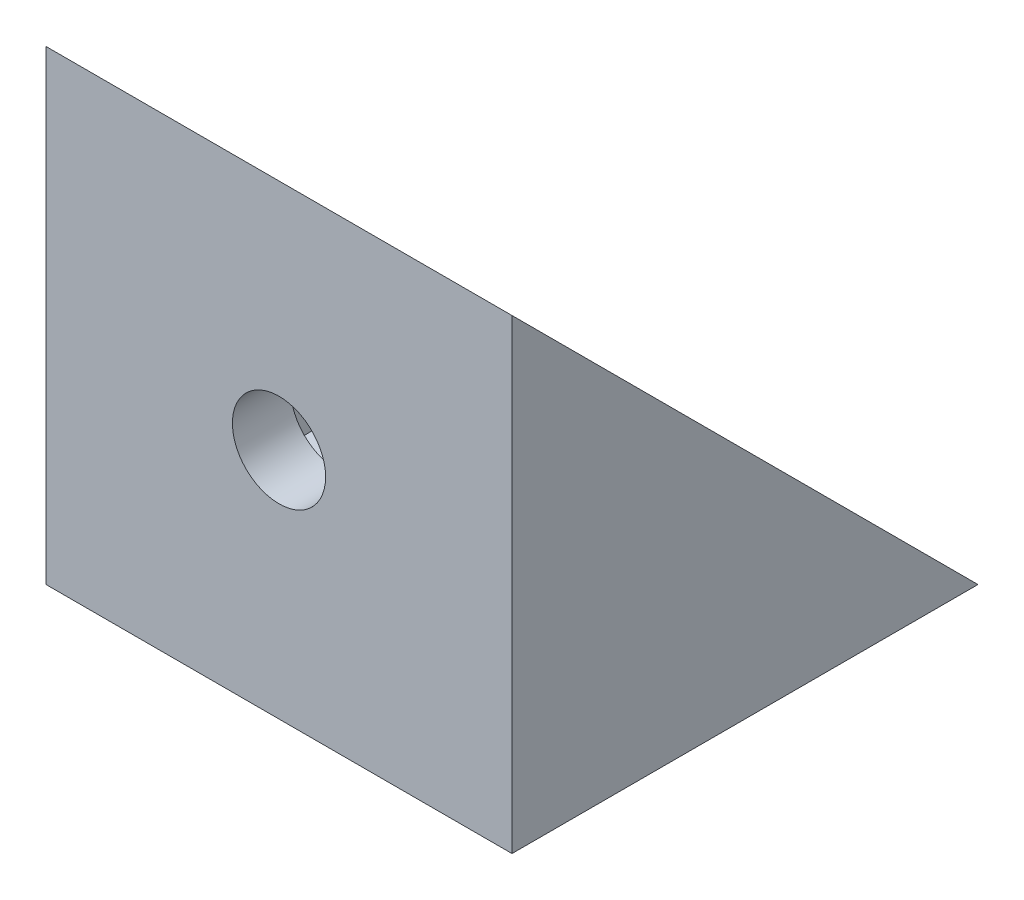
from build123d import *

# Parameters (mm, degrees)
AUFSATZ_LINEAR_AUSTRAGEN1_DEPTH      = 20
AUFSATZ_LINEAR_AUSTRAGEN1_DEPTH_BACK = 20
SCHNITT_LINEAR_AUSTRAGEN1_DEPTH      = 15
SCHNITT_LINEAR_AUSTRAGEN1_DEPTH_BACK = 15
SCHNITT_LINEAR_AUSTRAGEN2_REACH      = 62
SKIZZE3_R                            = 4
SCHNITT_LINEAR_AUSTRAGEN3_REACH      = 62
SKIZZE4_R                            = 4


with BuildPart() as part:
    # Skizze1 → Aufsatz-Linear austragen1 (new, two sides: drawn at the far end of the back side and taken through both)
    with BuildSketch(Plane(origin=(0, 0, 0), x_dir=(0, 0, -1), z_dir=(1, 0, 0)).offset(-AUFSATZ_LINEAR_AUSTRAGEN1_DEPTH_BACK)):
        Polygon((0, 0), (0, 40), (40, 0), align=None)
    extrude(amount=AUFSATZ_LINEAR_AUSTRAGEN1_DEPTH + AUFSATZ_LINEAR_AUSTRAGEN1_DEPTH_BACK)

    # Skizze2 → Schnitt-Linear austragen1 (cut, two sides: drawn at the far end of the back side and taken through both)
    with BuildSketch(Plane(origin=(0, 0, 0), x_dir=(0, 0, -1), z_dir=(1, 0, 0)).offset(-SCHNITT_LINEAR_AUSTRAGEN1_DEPTH_BACK)):
        Polygon((5, 35), (5, 5), (35, 5), align=None)
    extrude(amount=SCHNITT_LINEAR_AUSTRAGEN1_DEPTH + SCHNITT_LINEAR_AUSTRAGEN1_DEPTH_BACK, mode=Mode.SUBTRACT)

    # Skizze3 → Schnitt-Linear austragen2 (cut, up to next)
    with BuildSketch(Plane.XY, mode=Mode.PRIVATE) as schnitt_linear_austragen2_sk1:
        with Locations((0, 20)):
            Circle(SKIZZE3_R)
    schnitt_linear_austragen2_tool1 = extrude(schnitt_linear_austragen2_sk1.sketch, amount=-SCHNITT_LINEAR_AUSTRAGEN2_REACH, mode=Mode.PRIVATE) & part.part
    add(schnitt_linear_austragen2_tool1.solids().sort_by_distance((0, 20, 0))[0], mode=Mode.SUBTRACT)

    # Skizze4 → Schnitt-Linear austragen3 (cut, up to next)
    with BuildSketch(Plane.XZ, mode=Mode.PRIVATE) as schnitt_linear_austragen3_sk1:
        with Locations((0, -20)):
            Circle(SKIZZE4_R)
    schnitt_linear_austragen3_tool1 = extrude(schnitt_linear_austragen3_sk1.sketch, amount=-SCHNITT_LINEAR_AUSTRAGEN3_REACH, mode=Mode.PRIVATE) & part.part
    add(schnitt_linear_austragen3_tool1.solids().sort_by_distance((0, 0, -20))[0], mode=Mode.SUBTRACT)


solid = part.part
